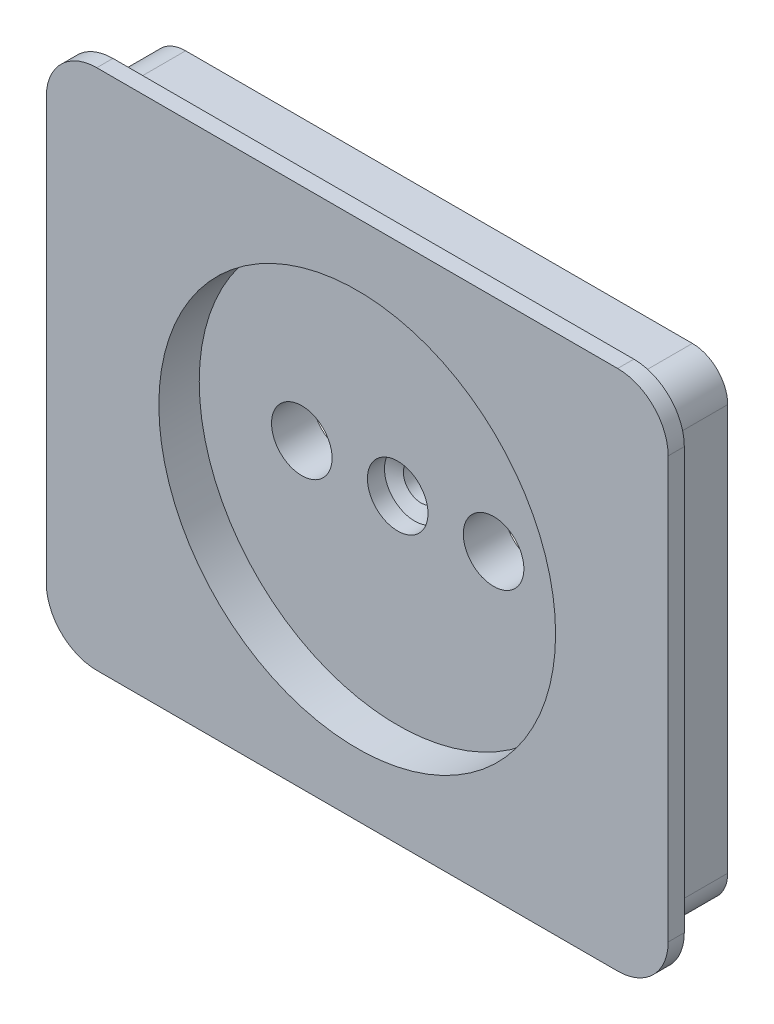
from build123d import *

# Parameters (mm, degrees)
SKETCH1_W           = 57.2
SKETCH1_H           = 47.2
SKETCH1_R           = 1.75
SKETCH1_R_2         = 3
BOSS_EXTRUDE1_DEPTH = 8.1
SKETCH2_R           = 19.65
CUT_EXTRUDE1_DEPTH  = 4
SKETCH3_R           = 3
CUT_EXTRUDE2_DEPTH  = 1.7
SKETCH5_W           = 57.2
SKETCH5_H           = 47.2
BOSS_EXTRUDE2_DEPTH = 1.6
FILLET1_R           = 3.5
FILLET2_R           = 5
CUT_EXTRUDE7_DEPTH  = 41.418714725
CUT_EXTRUDE8_DEPTH  = 0.01


with BuildPart() as part:
    # Sketch1 → Boss-Extrude1 (new body)
    with BuildSketch(Plane.XY):
        Rectangle(SKETCH1_W, SKETCH1_H)
        Circle(SKETCH1_R, mode=Mode.SUBTRACT)
        with Locations((-9.5, 0)):
            Circle(SKETCH1_R_2, mode=Mode.SUBTRACT)
        with Locations((9.5, 0)):
            Circle(SKETCH1_R_2, mode=Mode.SUBTRACT)
    extrude(amount=BOSS_EXTRUDE1_DEPTH)

    # Sketch2 → Cut-Extrude1 (cut)
    with BuildSketch(Plane.XY.offset(8.1)):
        Circle(SKETCH2_R)
    extrude(amount=-CUT_EXTRUDE1_DEPTH, mode=Mode.SUBTRACT)

    # Sketch3 → Cut-Extrude2 (cut)
    with BuildSketch(Plane.XY.offset(4.1)):
        Circle(SKETCH3_R)
    extrude(amount=-CUT_EXTRUDE2_DEPTH, mode=Mode.SUBTRACT)

    # Sketch4 → Cut-Revolve1 (revolve, cut)
    with BuildSketch(Plane(origin=(0, 0, 0), x_dir=(1, 0, 0), z_dir=(0, 1, 0))):
        Polygon((0, -2.4), (0, -0.9), (3, -2.4), align=None)
    revolve(axis=Axis((0, 0, 2.4), (0, 0, -1)), mode=Mode.SUBTRACT)

    # Sketch5 → Boss-Extrude2 (add)
    with BuildSketch(Plane.XY.offset(8.1)):
        Polygon((-30.8, 0), (-30.8, -25.85), (30.8, -25.85), (30.8, 25.85), (-30.8, 25.85), align=None)
        Rectangle(SKETCH5_W, SKETCH5_H, mode=Mode.SUBTRACT)
    extrude(amount=-BOSS_EXTRUDE2_DEPTH)

    # Fillet1
    fillet1_edges = [part.edges().sort_by_distance(p)[0] for p in [
        (28.6, -23.6, 3.25),
        (-28.6, -23.6, 3.25),
        (-28.6, 23.6, 3.25),
        (28.6, 23.6, 3.25),
    ]]
    fillet(fillet1_edges, radius=FILLET1_R)

    # Fillet2
    fillet2_edges = [part.edges().sort_by_distance(p)[0] for p in [
        (-30.8, 25.85, 7.3),
        (30.8, 25.85, 7.3),
        (30.8, -25.85, 7.3),
        (-30.8, -25.85, 7.3),
    ]]
    fillet(fillet2_edges, radius=FILLET2_R)

    # Sketch9 → Cut-Extrude7 (cut, through all)
    with BuildSketch(Plane.XY.offset(4.1)):
        with BuildLine():
            Line((-26.17, 3.67), (-20.493986923, 3.67))
            ThreePointArc((-20.493986923, 3.67), (0, 20.82), (20.493986923, 3.67))
            Line((20.493986923, 3.67), (26.17, 3.67))
            Line((26.17, 3.67), (26.17, -3.67))
            Line((26.17, -3.67), (20.493986923, -3.67))
            ThreePointArc((20.493986923, -3.67), (0, -20.82), (-20.493986923, -3.67))
            Line((-20.493986923, -3.67), (-26.17, -3.67))
            Line((-26.17, -3.67), (-26.17, 3.67))
        make_face()
        with BuildLine():
            Line((-26, 3.5), (-20.351228464, 3.5))
            ThreePointArc((-20.351228464, 3.5), (0, 20.65), (20.351228464, 3.5))
            Line((20.351228464, 3.5), (26, 3.5))
            Line((26, 3.5), (26, -3.5))
            Line((26, -3.5), (20.351228464, -3.5))
            ThreePointArc((20.351228464, -3.5), (0, -20.65), (-20.351228464, -3.5))
            Line((-20.351228464, -3.5), (-26, -3.5))
            Line((-26, -3.5), (-26, 3.5))
        make_face(mode=Mode.SUBTRACT)
    extrude(amount=-CUT_EXTRUDE7_DEPTH, mode=Mode.SUBTRACT)

    # Sketch11 → Cut-Extrude8 (cut)
    with BuildSketch(Plane.XY.offset(4.1)):
        with BuildLine():
            Line((20.493986923, -3.67), (26.17, -3.67))
            Line((26.17, -3.67), (26.17, 3.67))
            Line((26.17, 3.67), (20.493986923, 3.67))
            ThreePointArc((20.493986923, 3.67), (0, 20.82), (-20.493986923, 3.67))
            Line((-20.493986923, 3.67), (-26.17, 3.67))
            Line((-26.17, 3.67), (-26.17, -3.67))
            Line((-26.17, -3.67), (-20.493986923, -3.67))
            ThreePointArc((-20.493986923, -3.67), (0, -20.82), (20.493986923, -3.67))
        make_face()
    extrude(amount=-CUT_EXTRUDE8_DEPTH, mode=Mode.SUBTRACT)


with BuildPart() as cut_extrude8_piece_1:
    # of the separate pieces the step leaves, piece 1, a body of its own (cut_extrude8_pieces)
    add(part.part.solids().sort_by_distance((-25.8, -25.85, 6.5))[0])


with BuildPart() as cut_extrude8_piece_2:
    # of the separate pieces the step leaves, piece 2, a body of its own (cut_extrude8_pieces)
    add(part.part.solids().sort_by_distance((-6.5, 0, 0))[0])


solid = Compound([cut_extrude8_piece_1.part, cut_extrude8_piece_2.part])
